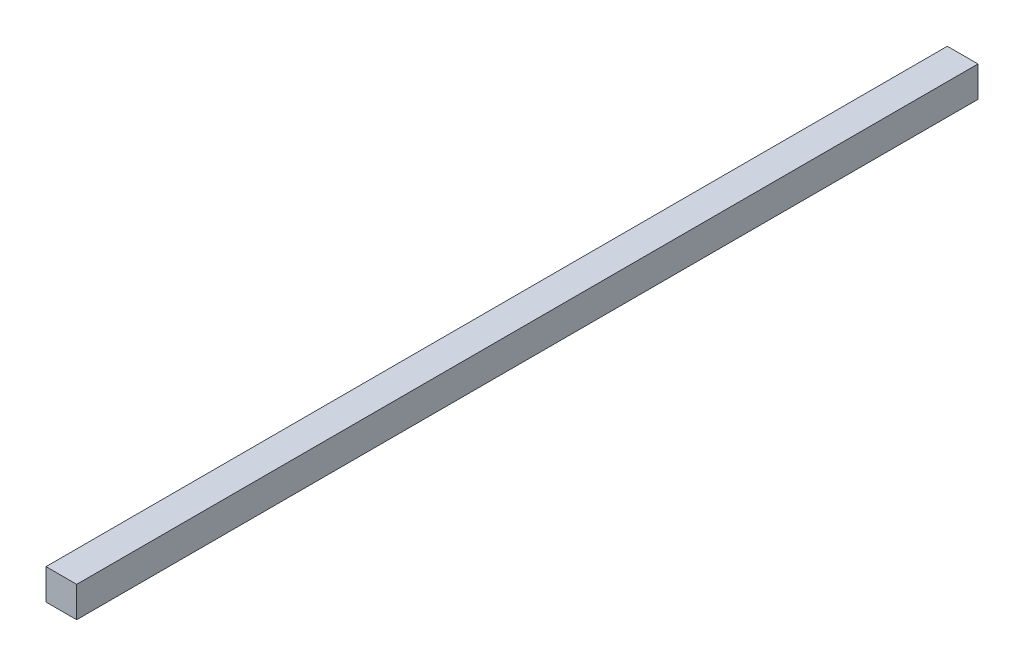
from build123d import *

# Parameters (mm, degrees)
SKETCH1_W           = 41.4909
SKETCH1_H           = 1.41224
BOSS_EXTRUDE2_DEPTH = 1.41224


with BuildPart() as part:
    # Sketch1 → Boss-Extrude2 (new body)
    with BuildSketch(Plane(origin=(0, 0, 0), x_dir=(0, 0, -1), z_dir=(1, 0, 0))):
        with Locations((20.74545, 0.70612)):
            Rectangle(SKETCH1_W, SKETCH1_H)
    extrude(amount=BOSS_EXTRUDE2_DEPTH)


solid = part.part
